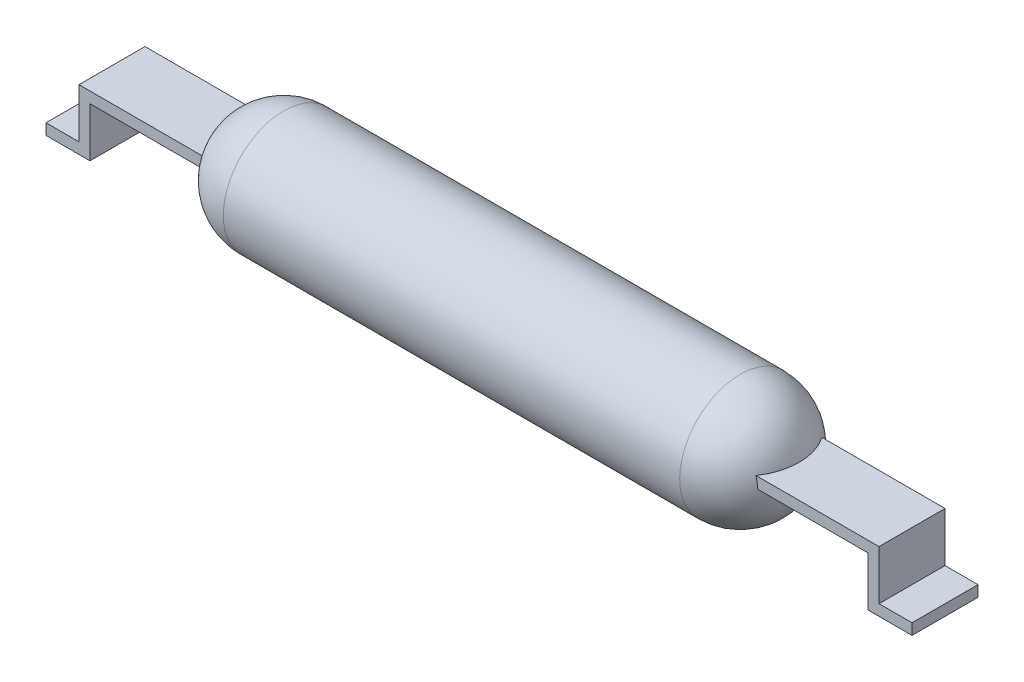
from build123d import *

# Parameters (mm, degrees)
ESQUISSE1_W             = 1.05
ESQUISSE1_H             = 0.11
CONG_2_R                = 0.11
BOSS_EXTRU_1_DEPTH      = 0.06
BOSS_EXTRU_1_DEPTH_BACK = 0.06


with BuildPart() as part:
    # Esquisse1 → Révolution2 (revolve)
    with BuildSketch(Plane(origin=(0, 0, 0), x_dir=(1, 0, 0), z_dir=(0, 1, 0))):
        with Locations((0, 0.055)):
            Rectangle(ESQUISSE1_W, ESQUISSE1_H)
    revolve(axis=Axis((-0.525, 0, 0), (1, 0, 0)))

    # Congé2
    cong_2_edges = [part.edges().sort_by_distance(p)[0] for p in [
        (0.525, 0, 0.11),
        (-0.525, 0, 0.11),
    ]]
    fillet(cong_2_edges, radius=CONG_2_R)

    # Esquisse2 → Boss.-Extru.1 (add, two sides: drawn at the far end of the back side and taken through both)
    with BuildSketch(Plane.XY.offset(-BOSS_EXTRU_1_DEPTH_BACK)):
        Polygon((-0.7075, -0.085), (-0.7875, -0.085), (-0.7875, -0.065), (-0.7275, -0.065), (-0.7275, 0.025), (-0.415, 0.025), (-0.415, 0.005), (-0.7075, 0.005), align=None)
        Polygon((0.415, 0.005), (0.7075, 0.005), (0.7075, -0.085), (0.7875, -0.085), (0.7875, -0.065), (0.7275, -0.065), (0.7275, 0.025), (0.415, 0.025), align=None)
    extrude(amount=BOSS_EXTRU_1_DEPTH + BOSS_EXTRU_1_DEPTH_BACK)


solid = part.part
